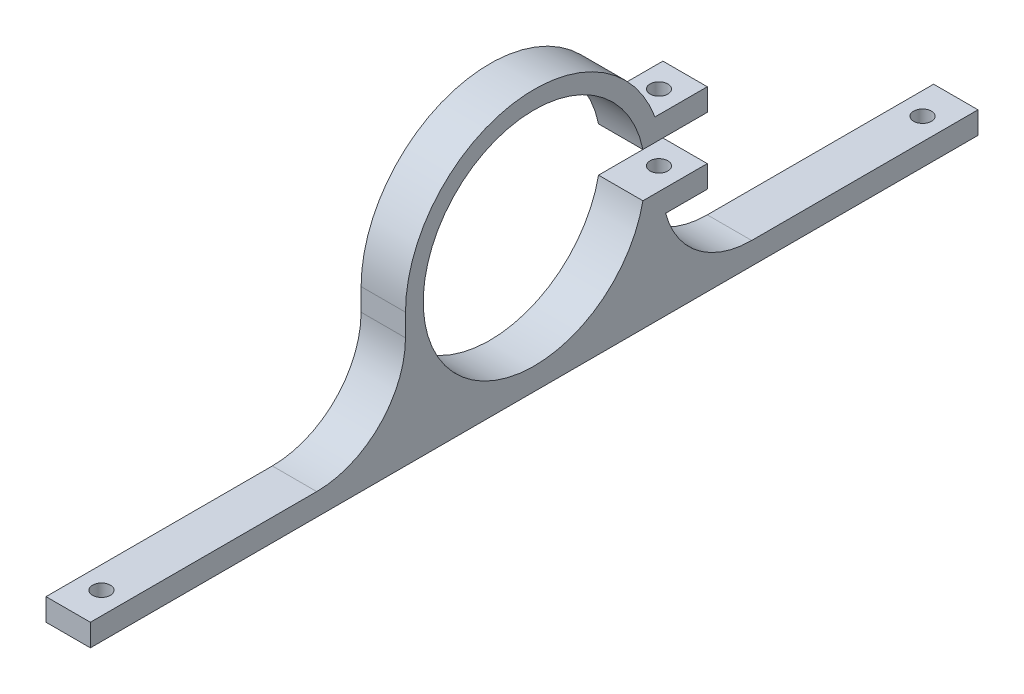
from build123d import *

# Parameters (mm, degrees)
SALIENTE_EXTRUIR1_DEPTH = 10
CROQUIS4_R              = 2
CORTAR_EXTRUIR1_DEPTH   = 23
CROQUIS5_R              = 2
CORTAR_EXTRUIR2_DEPTH   = 23


with BuildPart() as part:
    # Croquis2 → Saliente-Extruir1 (new body)
    with BuildSketch(Plane(origin=(0, 0, 0), x_dir=(0, 0, -1), z_dir=(1, 0, 0))):
        with BuildLine():
            Line((-100, 5), (-100, 0))
            Line((-100, 0), (100, 0))
            Line((100, 0), (100, 5))
            Line((100, 5), (49, 5))
            ThreePointArc((49, 5), (36.752551286, 9.188611699), (29.635083269, 20))
            Line((29.635083269, 20), (39, 20))
            Line((39, 20), (39, 25))
            Line((39, 25), (24.494897428, 25))
            ThreePointArc((24.494897428, 25), (-25, 30), (24.494897428, 35))
            Line((24.494897428, 35), (39, 35))
            Line((39, 35), (39, 40))
            Line((39, 40), (27.221315178, 40))
            ThreePointArc((27.221315178, 40), (-5.078477126, 58.551866315), (-29, 30))
            Line((-29, 30), (-29, 25))
            ThreePointArc((-29, 25), (-34.857864376, 10.857864376), (-49, 5))
            Line((-49, 5), (-100, 5))
        make_face()
    extrude(amount=SALIENTE_EXTRUIR1_DEPTH)

    # Croquis4 → Cortar-Extruir1 (cut)
    with BuildSketch(Plane(origin=(0, 40, 0), x_dir=(1, 0, 0), z_dir=(0, 1, 0))):
        with Locations(Location((5, 33.110657589, 0), (0, 0, 270))):
            Circle(CROQUIS4_R)
    extrude(amount=-CORTAR_EXTRUIR1_DEPTH, mode=Mode.SUBTRACT)

    # Croquis5 → Cortar-Extruir2 (cut)
    with BuildSketch(Plane(origin=(0, 5, 0), x_dir=(1, 0, 0), z_dir=(0, 1, 0))):
        with Locations(Location((5, -92.5, 0), (0, 0, 270))):
            Circle(CROQUIS5_R)
        with Locations(Location((5, 92.5, 0), (0, 0, 270))):
            Circle(CROQUIS5_R)
    extrude(amount=-CORTAR_EXTRUIR2_DEPTH, mode=Mode.SUBTRACT)


solid = part.part
